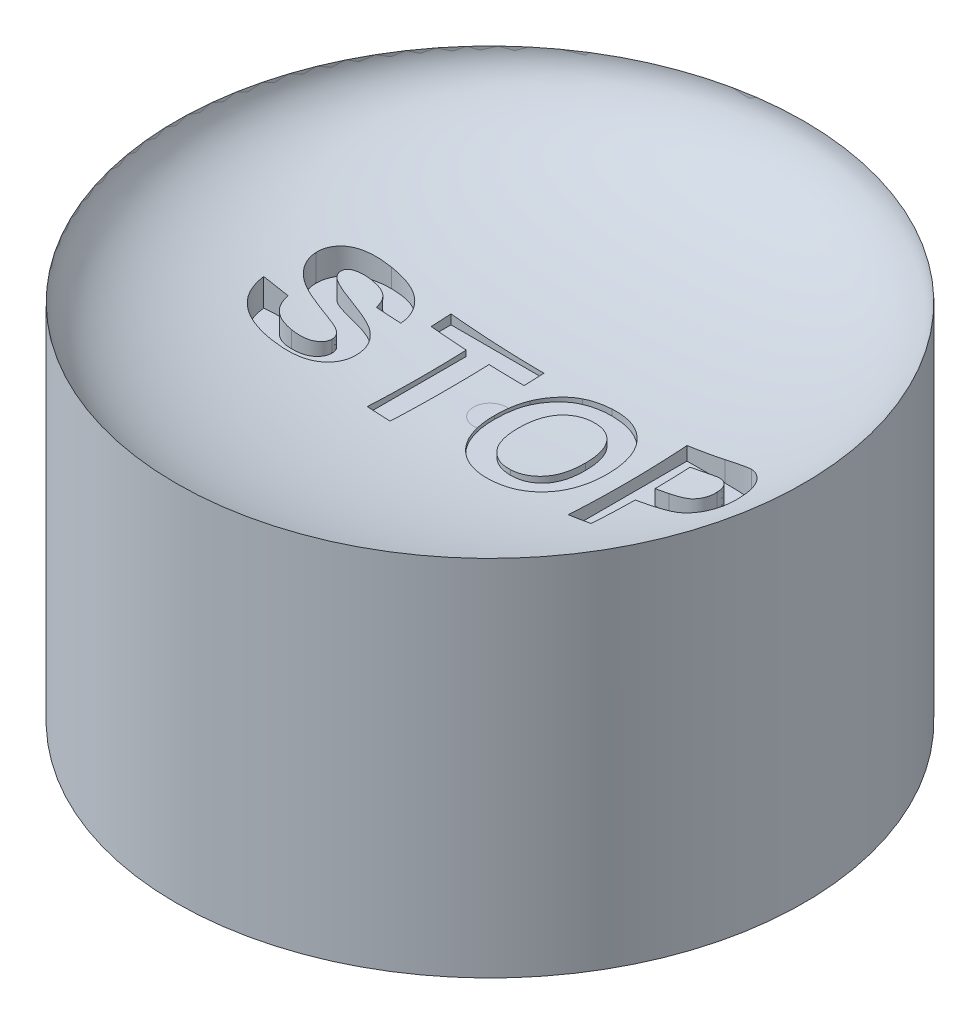
from build123d import *

# Parameters (mm, degrees)
SKETCH1_R           = 9.5
BOSS_EXTRUDE1_DEPTH = 8
CUT_EXTRUDE1_DEPTH  = 2.1


with BuildPart() as part:
    # Sketch1 → Boss-Extrude1 (new body)
    with BuildSketch(Plane(origin=(0, 0, 0), x_dir=(1, 0, 0), z_dir=(0, 1, 0))):
        with Locations(Location((0, 0, 0), (0, 0, 270))):
            Circle(SKETCH1_R)
    extrude(amount=BOSS_EXTRUDE1_DEPTH)

    # Sketch6 → Revolve4 (revolve)
    with BuildSketch(Plane(origin=(0, 0, 0), x_dir=(0, 0, -1), z_dir=(1, 0, 0)), mode=Mode.PRIVATE) as revolve4_sk:
        with BuildLine():
            Line((-9.5, 8), (-9.5, 11))
            add(Edge.make_bspline(
                [(-9.5, 11), (-9.5, 8), (-0.5, 8)],
                knots=[3.141592654, 3.141592654, 3.141592654, 4.71238898, 4.71238898, 4.71238898], degree=2, weights=[1, 0.707106781, 1]))
            Line((-0.5, 8), (-9.5, 8))
        make_face()
    revolve(revolve4_sk.sketch.rotate(Axis((0, 8, 0), (0, 1, 0)), 180), axis=Axis((0, 8, 0), (0, 1, 0)))

    # Sketch7 → Cut-Extrude1 (cut)
    # profile 1 of 4: a face of its own
    with BuildSketch(Plane(origin=(0, 10, 0), x_dir=(1, 0, 0), z_dir=(0, 1, 0))):
        with BuildLine():
            Line((-6.369377081, -0.481548891), (-5.677906666, -0.435450863))
            add(Edge.make_bspline(
                [(-5.677906666, -0.435450863), (-5.672397917, -0.464379551), (-5.661697523, -0.520571685), (-5.637923255, -0.600653149), (-5.611754366, -0.675311785), (-5.58048111, -0.743747006), (-5.546244882, -0.807223796), (-5.506233164, -0.863933856), (-5.463237275, -0.915687794), (-5.415128835, -0.960626829), (-5.362715314, -0.999985056), (-5.305735174, -1.033551064), (-5.244805843, -1.06260305), (-5.179778343, -1.086526439), (-5.109982465, -1.104385366), (-5.036026233, -1.117090934), (-4.957803581, -1.125227228), (-4.904344628, -1.126347352), (-4.876953435, -1.126921279)],
                knots=[0, 0, 0, 0, 1.204560339, 2.339781841, 3.415289417, 4.440034832, 5.416475564, 6.362424008, 7.275913008, 8.16578645, 9.05021719, 9.95355393, 10.867835453, 11.809845306, 12.784702352, 13.812224031, 14.87903166, 16, 16, 16, 16], degree=3))
            add(Edge.make_bspline(
                [(-4.876953435, -1.126921279), (-4.848122472, -1.126606735), (-4.792044763, -1.12599493), (-4.710781963, -1.118404961), (-4.634797554, -1.107531513), (-4.564762504, -1.090319099), (-4.499368977, -1.071069738), (-4.440241075, -1.044734562), (-4.386421968, -1.014360743), (-4.338050307, -0.979894328), (-4.295836313, -0.941668602), (-4.258905405, -0.901762183), (-4.226741023, -0.861037234), (-4.201425378, -0.817686559), (-4.180937766, -0.77346344), (-4.16739689, -0.727048624), (-4.158249226, -0.679507896), (-4.157200255, -0.647017048), (-4.156671753, -0.630647199)],
                knots=[0, 0, 0, 0, 1.417779877, 2.757654889, 4.012140507, 5.189587551, 6.302846416, 7.360586765, 8.365575446, 9.33904572, 10.275781718, 11.161696098, 12.012180333, 12.822428111, 13.625933072, 14.403138519, 15.195454004, 16, 16, 16, 16], degree=3))
            add(Edge.make_bspline(
                [(-4.156671753, -0.630647199), (-4.157319916, -0.610137106), (-4.158587952, -0.570012111), (-4.173853841, -0.512649035), (-4.196747499, -0.459503803), (-4.231217436, -0.41136137), (-4.277553517, -0.367366202), (-4.336659805, -0.3262098), (-4.410186161, -0.289185134), (-4.464733153, -0.268532706), (-4.49376358, -0.257541288)],
                knots=[0, 0, 0, 0, 0.90494901, 1.770400303, 2.607161909, 3.452839393, 4.36912122, 5.420987164, 6.627424851, 8, 8, 8, 8], degree=3))
            add(Edge.make_bspline(
                [(-4.49376358, -0.257541288), (-4.506219768, -0.253367162), (-4.534094693, -0.244026146), (-4.581646356, -0.230669374), (-4.638923598, -0.213990314), (-4.70675411, -0.1950319), (-4.785115085, -0.175642433), (-4.873131333, -0.15175681), (-4.971875871, -0.127988663), (-5.040957668, -0.110443022), (-5.077191743, -0.101240163)],
                knots=[0, 0, 0, 0, 0.521821638, 1.167752076, 1.961721917, 2.891982557, 3.96540661, 5.168436773, 6.514817513, 8, 8, 8, 8], degree=3))
            add(Edge.make_bspline(
                [(-5.077191743, -0.101240163), (-5.124379263, -0.08945854), (-5.215419867, -0.066727826), (-5.345264615, -0.026291496), (-5.464854003, 0.013884236), (-5.573036578, 0.057477061), (-5.671005639, 0.101532577), (-5.757176507, 0.149143771), (-5.83334738, 0.197838027), (-5.877733915, 0.234233303), (-5.899033143, 0.251697862)],
                knots=[0, 0, 0, 0, 1.293880989, 2.496331788, 3.617634808, 4.64976062, 5.598842568, 6.473791081, 7.267636666, 8, 8, 8, 8], degree=3))
            add(Edge.make_bspline(
                [(-5.899033143, 0.251697862), (-5.925446954, 0.276428999), (-5.977233672, 0.324916681), (-6.045402849, 0.404591248), (-6.102683521, 0.488754681), (-6.149831784, 0.57678574), (-6.186135055, 0.669191217), (-6.211866347, 0.765352589), (-6.228520574, 0.865520825), (-6.230220023, 0.933737767), (-6.231082998, 0.968378136)],
                knots=[0, 0, 0, 0, 1.064429417, 2.086912298, 3.078678339, 4.055528992, 5.020032834, 5.993708893, 6.981211098, 8, 8, 8, 8], degree=3))
            add(Edge.make_bspline(
                [(-6.231082998, 0.968378136), (-6.229402347, 1.01320236), (-6.226068436, 1.102120239), (-6.1954943, 1.232817385), (-6.147868151, 1.358930064), (-6.092633112, 1.459068201), (-6.039564156, 1.534823081), (-5.995494251, 1.589184089), (-5.947079204, 1.640060767), (-5.893655829, 1.686212072), (-5.83720787, 1.730341348), (-5.775548315, 1.769528675), (-5.7104254, 1.806440968), (-5.616185122, 1.850198774), (-5.488232684, 1.895798707), (-5.321759688, 1.934236556), (-5.140503559, 1.957342668), (-5.014838128, 1.9601773), (-4.949701885, 1.961646576)],
                knots=[0, 0, 0, 0, 1.180131776, 2.341029169, 3.518901375, 4.725685298, 5.343762192, 5.955650671, 6.568945152, 7.192346361, 7.815201106, 8.455999361, 9.116257477, 9.787318263, 11.192748436, 12.688084276, 14.283332633, 16, 16, 16, 16], degree=3))
            add(Edge.make_bspline(
                [(-4.949701885, 1.961646576), (-4.896368275, 1.960933372), (-4.792635543, 1.959546205), (-4.642262898, 1.945518954), (-4.501806689, 1.923687197), (-4.371759793, 1.892347812), (-4.252061617, 1.850940259), (-4.142248177, 1.801616033), (-4.042412787, 1.7430558), (-3.953770844, 1.674923504), (-3.874799369, 1.599812018), (-3.805909387, 1.517768475), (-3.746837518, 1.429829035), (-3.697202518, 1.336057965), (-3.658224284, 1.235973142), (-3.62959631, 1.129699455), (-3.61066152, 1.017487043), (-3.605915457, 0.940597978), (-3.603495421, 0.901391939)],
                knots=[0, 0, 0, 0, 1.325124071, 2.577337985, 3.749592149, 4.855247722, 5.896868755, 6.892903601, 7.842551483, 8.766257401, 9.665194363, 10.546067736, 11.423174165, 12.293291263, 13.177512979, 14.086532529, 15.024315359, 16, 16, 16, 16], degree=3))
            Line((-3.603495421, 0.901391939), (-4.294965836, 0.855293912))
            add(Edge.make_bspline(
                [(-4.294965836, 0.855293912), (-4.298954754, 0.876976569), (-4.306728741, 0.919233814), (-4.323631517, 0.979754774), (-4.342697028, 1.035729759), (-4.365012221, 1.08715841), (-4.391966278, 1.133119591), (-4.421300038, 1.175059265), (-4.453822686, 1.212418609), (-4.490611059, 1.244174605), (-4.530400951, 1.273071259), (-4.575747405, 1.296232597), (-4.624750354, 1.317721219), (-4.679274064, 1.333875395), (-4.738271481, 1.346689466), (-4.80177697, 1.356188987), (-4.869922171, 1.360827187), (-4.916803557, 1.361845416), (-4.941058505, 1.362372216)],
                knots=[0, 0, 0, 0, 1.151066407, 2.24330871, 3.278475654, 4.238599069, 5.165719782, 6.056502506, 6.909492653, 7.744782051, 8.590364415, 9.471203867, 10.39832458, 11.382154319, 12.435022857, 13.550631277, 14.73277401, 16, 16, 16, 16], degree=3))
            add(Edge.make_bspline(
                [(-4.941058505, 1.362372216), (-4.966277027, 1.361907139), (-5.015340789, 1.36100231), (-5.086839766, 1.355449507), (-5.153911172, 1.345199568), (-5.216884412, 1.331856691), (-5.275675369, 1.313704629), (-5.330159976, 1.291571163), (-5.380587505, 1.26551326), (-5.411336013, 1.245011801), (-5.426528359, 1.234882358)],
                knots=[0, 0, 0, 0, 1.186678824, 2.308736671, 3.37120409, 4.377216403, 5.334874112, 6.262130804, 7.141346615, 8, 8, 8, 8], degree=3))
            add(Edge.make_bspline(
                [(-5.426528359, 1.234882358), (-5.443914724, 1.221045251), (-5.477586715, 1.19424707), (-5.513824904, 1.141034994), (-5.535640377, 1.08093355), (-5.538266117, 1.038431735), (-5.539612583, 1.016637008)],
                knots=[0, 0, 0, 0, 1.037857257, 2.010007357, 2.979541333, 4, 4, 4, 4], degree=3))
            add(Edge.make_bspline(
                [(-5.539612583, 1.016637008), (-5.538511419, 0.996268389), (-5.536342301, 0.956145451), (-5.514463948, 0.89914995), (-5.480818023, 0.846339518), (-5.449381425, 0.817652199), (-5.433010894, 0.802713349)],
                knots=[0, 0, 0, 0, 0.98538058, 1.941042925, 2.927803204, 4, 4, 4, 4], degree=3))
            add(Edge.make_bspline(
                [(-5.433010894, 0.802713349), (-5.420018769, 0.793017286), (-5.390986776, 0.77135062), (-5.33780592, 0.743810238), (-5.273615231, 0.713982341), (-5.196951317, 0.684822279), (-5.108323684, 0.655716345), (-5.007726943, 0.625326385), (-4.895099222, 0.594528412), (-4.773311346, 0.564702083), (-4.649662351, 0.535384515), (-4.531667521, 0.503332139), (-4.421949299, 0.472083551), (-4.321016415, 0.439329959), (-4.228348578, 0.40744444), (-4.144395938, 0.374695715), (-4.068582041, 0.342802121), (-3.980174633, 0.298946171), (-3.879973728, 0.239541514), (-3.774951876, 0.153186937), (-3.68207345, 0.056118753), (-3.61735823, -0.035409849), (-3.572902261, -0.114126882), (-3.544277307, -0.176873523), (-3.519514477, -0.242992661), (-3.499357601, -0.312557363), (-3.484748715, -0.385665514), (-3.472659013, -0.461758568), (-3.46648216, -0.541468494), (-3.465632873, -0.595824991), (-3.465201338, -0.623444383)],
                knots=[0, 0, 0, 0, 0.511875881, 1.143829537, 1.88775736, 2.750598373, 3.734912702, 4.837306479, 6.073130119, 7.42648979, 8.801963576, 10.091065733, 11.292408984, 12.408830014, 13.446061236, 14.39066453, 15.257936293, 16.045629259, 17.510392066, 18.929669597, 20.331293837, 21.746891395, 22.460690638, 23.187651344, 23.925159671, 24.69163991, 25.474819891, 26.281170188, 27.126635539, 28, 28, 28, 28], degree=3))
            add(Edge.make_bspline(
                [(-3.465201338, -0.623444383), (-3.465794713, -0.648915636), (-3.466973099, -0.699499079), (-3.47520798, -0.774577677), (-3.487943016, -0.848323018), (-3.506795246, -0.920827551), (-3.531804652, -0.991948644), (-3.559963256, -1.062712771), (-3.595174005, -1.131576715), (-3.63524864, -1.198597512), (-3.679452783, -1.263724869), (-3.729544287, -1.323803371), (-3.782580974, -1.380837384), (-3.841951746, -1.43163332), (-3.903990325, -1.480304155), (-3.971534292, -1.523407864), (-4.04300119, -1.562412906), (-4.11884289, -1.597028066), (-4.199328296, -1.627192049), (-4.284352871, -1.654040091), (-4.374682638, -1.676013152), (-4.469564374, -1.694846832), (-4.569345303, -1.70916936), (-4.673900679, -1.719169815), (-4.78325427, -1.724809468), (-4.85773964, -1.725727841), (-4.895680759, -1.726195638)],
                knots=[0, 0, 0, 0, 0.900570041, 1.788444861, 2.667795364, 3.545012114, 4.433698372, 5.332345486, 6.235991676, 7.164928091, 8.092777575, 9.015680987, 9.928493428, 10.842962589, 11.775229507, 12.714851019, 13.672254427, 14.652424454, 15.660007982, 16.709910502, 17.803296389, 18.945495772, 20.129342395, 21.366102753, 22.658353839, 24, 24, 24, 24], degree=3))
            add(Edge.make_bspline(
                [(-4.895680759, -1.726195638), (-4.950461881, -1.725301243), (-5.057122026, -1.723559835), (-5.21208006, -1.707972861), (-5.357420438, -1.684115874), (-5.492906556, -1.649491337), (-5.618704011, -1.605041247), (-5.734755429, -1.550288552), (-5.840499483, -1.484906133), (-5.937245868, -1.410479623), (-6.023705591, -1.325652783), (-6.101450349, -1.232183195), (-6.169431341, -1.129229181), (-6.227603886, -1.016951772), (-6.277438685, -0.895957941), (-6.318537923, -0.766192129), (-6.34948349, -0.627035422), (-6.362631198, -0.530883131), (-6.369377081, -0.481548891)],
                knots=[0, 0, 0, 0, 1.217954099, 2.371385517, 3.459848295, 4.490682126, 5.476952527, 6.422732854, 7.338496285, 8.236688651, 9.131557988, 10.026443255, 10.935708282, 11.869506048, 12.834296687, 13.842423496, 14.892981177, 16, 16, 16, 16], degree=3))
        make_face()
    # profile 2 of 4: a face of its own
    with BuildSketch(Plane(origin=(0, 10, 0), x_dir=(1, 0, 0), z_dir=(0, 1, 0))):
        Polygon((-2.03616248, -1.680097611), (-2.03616248, 1.316274188), (-3.096417116, 1.316274188), (-3.096417116, 1.915548548), (-0.284437428, 1.915548548), (-0.284437428, 1.316274188), (-1.344692065, 1.316274188), (-1.344692065, -1.680097611), align=None)
    # profile 3 of 4: a face of its own
    with BuildSketch(Plane(origin=(0, 10, 0), x_dir=(1, 0, 0), z_dir=(0, 1, 0))):
        with BuildLine():
            add(Edge.make_bspline(
                [(0.038248766, 0.096117018), (0.038503215, 0.14055053), (0.03900292, 0.22781221), (0.047661655, 0.355828372), (0.059074541, 0.478536642), (0.077660408, 0.595454365), (0.099524173, 0.707128755), (0.126869941, 0.813526664), (0.159811907, 0.914274956), (0.186017502, 0.978601653), (0.198871581, 1.010154473)],
                knots=[0, 0, 0, 0, 1.141009212, 2.240794809, 3.294380675, 4.305229195, 5.280013876, 6.216333343, 7.125095522, 8, 8, 8, 8], degree=3))
            add(Edge.make_bspline(
                [(0.198871581, 1.010154473), (0.219883122, 1.055010463), (0.261659074, 1.144194862), (0.339243583, 1.270219588), (0.42718105, 1.389071116), (0.524747509, 1.500126377), (0.629452058, 1.601713496), (0.741788645, 1.688657443), (0.857766286, 1.763894499), (0.94025272, 1.801734266), (0.981097488, 1.820471366)],
                knots=[0, 0, 0, 0, 1.031372299, 2.050613973, 3.077158538, 4.108712802, 5.127684358, 6.111366908, 7.06480644, 8, 8, 8, 8], degree=3))
            add(Edge.make_bspline(
                [(0.981097488, 1.820471366), (1.008822764, 1.831843656), (1.064862616, 1.854829952), (1.151955141, 1.883518055), (1.242352204, 1.906825842), (1.335399967, 1.927660288), (1.432001847, 1.942026323), (1.531377259, 1.954071751), (1.634070053, 1.960384969), (1.703532761, 1.961221466), (1.738833818, 1.961646576)],
                knots=[0, 0, 0, 0, 0.92659354, 1.872881803, 2.832850937, 3.813025581, 4.820167273, 5.851730198, 6.908245912, 8, 8, 8, 8], degree=3))
            add(Edge.make_bspline(
                [(1.738833818, 1.961646576), (1.802043095, 1.960062127), (1.925744518, 1.956961338), (2.10643756, 1.934564712), (2.27742804, 1.896745946), (2.438137154, 1.842083812), (2.589950484, 1.773754957), (2.731688532, 1.689000795), (2.863561073, 1.588738622), (2.985313403, 1.474343357), (3.094960096, 1.346014361), (3.190453257, 1.204950419), (3.270559108, 1.051812569), (3.336530902, 0.887023325), (3.387225254, 0.710044433), (3.423851877, 0.521375258), (3.445611056, 0.320876829), (3.448182293, 0.183326026), (3.449502814, 0.112683497)],
                knots=[0, 0, 0, 0, 1.064641025, 2.083517118, 3.061799897, 4.009540929, 4.938075217, 5.861300345, 6.78508344, 7.723570974, 8.670267188, 9.622657076, 10.586935816, 11.576069104, 12.607749008, 13.683335114, 14.81022093, 16, 16, 16, 16], degree=3))
            add(Edge.make_bspline(
                [(3.449502814, 0.112683497), (3.448212793, 0.042514), (3.445701363, -0.094092901), (3.423536036, -0.29301801), (3.388427899, -0.480311781), (3.336506946, -0.655546368), (3.272504133, -0.820058926), (3.191573972, -0.97188998), (3.098080726, -1.11305347), (2.988589766, -1.23999962), (2.868886598, -1.3550514), (2.73718133, -1.45414176), (2.596475065, -1.53901076), (2.44548945, -1.607537074), (2.28520858, -1.661073461), (2.11510939, -1.699182836), (1.93510464, -1.721493277), (1.811885196, -1.724605324), (1.748917762, -1.726195638)],
                knots=[0, 0, 0, 0, 1.18845052, 2.313691126, 3.386664782, 4.412527756, 5.405809582, 6.372003093, 7.321919452, 8.268293321, 9.206237639, 10.129603466, 11.054616372, 11.9847576, 12.932764752, 13.912672021, 14.933336461, 16, 16, 16, 16], degree=3))
            add(Edge.make_bspline(
                [(1.748917762, -1.726195638), (1.685231074, -1.724601654), (1.56057793, -1.72148177), (1.378653262, -1.69923924), (1.206865547, -1.66111732), (1.045337116, -1.607392618), (0.892966314, -1.539907302), (0.751159921, -1.455905541), (0.619839551, -1.356187624), (0.499136192, -1.242490104), (0.389712935, -1.115917177), (0.296352437, -0.97566133), (0.215418055, -0.825313286), (0.151078747, -0.662595632), (0.099443704, -0.489182524), (0.064249777, -0.30407613), (0.04204159, -0.107785912), (0.039536149, 0.02690706), (0.038248766, 0.096117018)],
                knots=[0, 0, 0, 0, 1.080878253, 2.11558926, 3.1052859, 4.062802436, 5.000434901, 5.928596448, 6.853693179, 7.793554778, 8.738606028, 9.68692032, 10.647726704, 11.63151566, 12.651483354, 13.714466703, 14.825613081, 16, 16, 16, 16], degree=3))
        make_face()
        with BuildLine():
            add(Edge.make_bspline(
                [(0.729719181, 0.119886314), (0.730409951, 0.070149028), (0.731747615, -0.02616628), (0.745995503, -0.165965617), (0.767617819, -0.296658392), (0.79941661, -0.41809627), (0.839588331, -0.530367104), (0.888807017, -0.633564806), (0.946869266, -0.727843079), (1.015276862, -0.811211575), (1.089288518, -0.885643573), (1.169177497, -0.950046023), (1.25345495, -1.005477604), (1.343579133, -1.04924065), (1.437674401, -1.083971414), (1.536471808, -1.109723005), (1.640462598, -1.123863157), (1.711423027, -1.12589097), (1.747477198, -1.126921279)],
                knots=[0, 0, 0, 0, 1.313550922, 2.543666373, 3.708465049, 4.810029406, 5.85539231, 6.85404609, 7.825601258, 8.772642133, 9.696587791, 10.59409323, 11.479048685, 12.35559886, 13.234601248, 14.125357077, 15.047515647, 16, 16, 16, 16], degree=3))
            add(Edge.make_bspline(
                [(1.747477198, -1.126921279), (1.783536227, -1.125911846), (1.854506215, -1.123925119), (1.958369232, -1.109495852), (2.057362429, -1.08484803), (2.151083884, -1.05029524), (2.239960767, -1.00583729), (2.323915665, -0.951648369), (2.40246464, -0.886952916), (2.476395735, -0.813602229), (2.542956846, -0.729680008), (2.600524742, -0.635418005), (2.649719178, -0.531594406), (2.68989513, -0.418170371), (2.720911346, -0.294932493), (2.741651203, -0.161815568), (2.756014305, -0.019200218), (2.757346513, 0.079271977), (2.758032399, 0.129970257)],
                knots=[0, 0, 0, 0, 0.949153107, 1.868086493, 2.754172764, 3.630100905, 4.492260106, 5.365378617, 6.254840125, 7.166615376, 8.102436631, 9.067266169, 10.06813181, 11.121736829, 12.23011542, 13.408501285, 14.665770308, 16, 16, 16, 16], degree=3))
            add(Edge.make_bspline(
                [(2.758032399, 0.129970257), (2.757257682, 0.180179018), (2.755757371, 0.277413055), (2.742691204, 0.41822802), (2.721291237, 0.549234748), (2.691542919, 0.670399299), (2.652228647, 0.781741199), (2.605272351, 0.883564921), (2.548495519, 0.975338495), (2.48337945, 1.0570144), (2.411325521, 1.128904944), (2.333557903, 1.191842035), (2.249634751, 1.244209521), (2.160375138, 1.288269656), (2.06484978, 1.32095771), (1.964029439, 1.3448001), (1.857628798, 1.359482281), (1.784739042, 1.361394615), (1.747477198, 1.362372216)],
                knots=[0, 0, 0, 0, 1.332337092, 2.580197383, 3.749299508, 4.852775005, 5.886662144, 6.878700295, 7.822989687, 8.743523536, 9.644687758, 10.519443927, 11.392806431, 12.264866173, 13.155606721, 14.065961015, 15.011303331, 16, 16, 16, 16], degree=3))
            add(Edge.make_bspline(
                [(1.747477198, 1.362372216), (1.710210645, 1.361409653), (1.637311676, 1.359526734), (1.530745181, 1.344601469), (1.429607223, 1.321469521), (1.334095367, 1.286914976), (1.244058275, 1.243277958), (1.159828969, 1.189159358), (1.080743749, 1.126329076), (1.008044238, 1.053348507), (0.941873083, 0.970957376), (0.885068909, 0.878062423), (0.836630871, 0.775678176), (0.796890269, 0.663501569), (0.767430194, 0.54122401), (0.744787674, 0.40966728), (0.732072474, 0.268035119), (0.730520472, 0.170330621), (0.729719181, 0.119886314)],
                knots=[0, 0, 0, 0, 0.981996942, 1.920933313, 2.83127778, 3.712125466, 4.592427284, 5.463259035, 6.34592384, 7.249932058, 8.173122297, 9.125107726, 10.113123258, 11.154048744, 12.256187849, 13.424658091, 14.670364834, 16, 16, 16, 16], degree=3))
        make_face(mode=Mode.SUBTRACT)
    # profile 4 of 4: a face of its own
    with BuildSketch(Plane(origin=(0, 10, 0), x_dir=(1, 0, 0), z_dir=(0, 1, 0))):
        with BuildLine():
            Line((4.048777174, -1.680097611), (4.048777174, 1.915548548))
            Line((4.048777174, 1.915548548), (5.199067021, 1.915548548))
            add(Edge.make_bspline(
                [(5.199067021, 1.915548548), (5.251169099, 1.91549165), (5.350820517, 1.915382826), (5.492967237, 1.912359238), (5.620949063, 1.908079015), (5.734576049, 1.90274818), (5.834248018, 1.894793549), (5.919517853, 1.885582206), (5.990922493, 1.875673245), (6.03297057, 1.865418796), (6.051880533, 1.86080714)],
                knots=[0, 0, 0, 0, 1.460485487, 2.793352117, 3.985295279, 5.050041172, 5.981765236, 6.787433016, 7.454681457, 8, 8, 8, 8], degree=3))
            add(Edge.make_bspline(
                [(6.051880533, 1.86080714), (6.077026184, 1.853637146), (6.126934412, 1.839406387), (6.198437338, 1.80906867), (6.267354836, 1.773908874), (6.332821033, 1.732004752), (6.395058467, 1.684100252), (6.454252136, 1.630586039), (6.510717713, 1.57122054), (6.563674069, 1.506121028), (6.612175861, 1.435615768), (6.654093596, 1.359600519), (6.689211893, 1.278405684), (6.719132098, 1.192641432), (6.741207369, 1.101388229), (6.756656045, 1.005280114), (6.767410251, 0.904275052), (6.768171682, 0.835155425), (6.768560807, 0.799832222)],
                knots=[0, 0, 0, 0, 0.907145743, 1.80047177, 2.69161667, 3.591261238, 4.495029544, 5.415863088, 6.359363025, 7.337192411, 8.326890979, 9.326929023, 10.346104993, 11.395420813, 12.477187422, 13.601053412, 14.774031606, 16, 16, 16, 16], degree=3))
            add(Edge.make_bspline(
                [(6.768560807, 0.799832222), (6.767451024, 0.746189922), (6.765314631, 0.642925549), (6.741412184, 0.494883554), (6.704955074, 0.359656735), (6.651670372, 0.238547608), (6.586705251, 0.131080919), (6.515144833, 0.034200206), (6.433433352, -0.049174447), (6.345151305, -0.120388555), (6.251853316, -0.178667226), (6.158386439, -0.228348966), (6.063489474, -0.266545875), (5.998788935, -0.283188576), (5.966887294, -0.291394527)],
                knots=[0, 0, 0, 0, 1.312386234, 2.526415563, 3.661883817, 4.733421185, 5.753802465, 6.732107337, 7.675884281, 8.604170108, 9.50284679, 10.365392406, 11.194030444, 12, 12, 12, 12], degree=3))
            add(Edge.make_bspline(
                [(5.966887294, -0.291394527), (5.944117467, -0.295725883), (5.896121389, -0.304855865), (5.82000248, -0.313956795), (5.736800388, -0.324030533), (5.646172895, -0.330601191), (5.548229639, -0.336754336), (5.44300865, -0.339659439), (5.330660301, -0.343159499), (5.253331708, -0.34322239), (5.213472654, -0.343254808)],
                knots=[0, 0, 0, 0, 0.735353946, 1.55003838, 2.431865514, 3.394945452, 4.432993119, 5.54609699, 6.735134699, 8, 8, 8, 8], degree=3))
            Line((5.213472654, -0.343254808), (4.740247589, -0.343254808))
            Line((4.740247589, -0.343254808), (4.740247589, -1.680097611))
            Line((4.740247589, -1.680097611), (4.048777174, -1.680097611))
        make_face()
        with BuildLine():
            Line((4.740247589, 1.316274188), (4.740247589, 0.256019552))
            Line((4.740247589, 0.256019552), (5.155129838, 0.256019552))
            add(Edge.make_bspline(
                [(5.155129838, 0.256019552), (5.19090697, 0.25606588), (5.259353126, 0.256154512), (5.357558176, 0.259335881), (5.446453481, 0.263219331), (5.526224783, 0.269647237), (5.596390563, 0.278119062), (5.657420703, 0.288252432), (5.709386332, 0.299126597), (5.765580086, 0.317146831), (5.825662444, 0.346301926), (5.889823341, 0.388205121), (5.946188614, 0.438305332), (5.993091991, 0.497146295), (6.030557406, 0.562522014), (6.05738267, 0.633762497), (6.074703717, 0.709687041), (6.076285837, 0.76228194), (6.077090392, 0.789027997)],
                knots=[0, 0, 0, 0, 1.411705958, 2.700771114, 3.876961699, 4.922619712, 5.858038221, 6.66485904, 7.363650596, 7.950905807, 8.989198271, 9.987739806, 10.967313358, 11.951275539, 12.944273208, 13.927870418, 14.946261014, 16, 16, 16, 16], degree=3))
            add(Edge.make_bspline(
                [(6.077090392, 0.789027997), (6.075958069, 0.821604277), (6.073762646, 0.884765388), (6.049553251, 0.974717351), (6.012200922, 1.056349848), (5.958797697, 1.127122924), (5.894287857, 1.186637261), (5.821781489, 1.236155305), (5.739730187, 1.270808409), (5.681659858, 1.284235208), (5.652124199, 1.291064329)],
                knots=[0, 0, 0, 0, 1.085904563, 2.105425768, 3.088705091, 4.068969419, 5.045188284, 6.010769642, 6.988240112, 8, 8, 8, 8], degree=3))
            add(Edge.make_bspline(
                [(5.652124199, 1.291064329), (5.63941433, 1.293097169), (5.611202362, 1.297609444), (5.564308329, 1.302318563), (5.508832681, 1.306601502), (5.444708547, 1.310117924), (5.3721901, 1.312866951), (5.29103814, 1.315275776), (5.201466397, 1.315469294), (5.138802867, 1.315998457), (5.106150684, 1.316274188)],
                knots=[0, 0, 0, 0, 0.564603001, 1.253243608, 2.066786758, 3.005752288, 4.070476343, 5.250658742, 6.567396469, 8, 8, 8, 8], degree=3))
            Line((5.106150684, 1.316274188), (4.740247589, 1.316274188))
        make_face(mode=Mode.SUBTRACT)
    extrude(amount=-CUT_EXTRUDE1_DEPTH, mode=Mode.SUBTRACT)


solid = part.part
